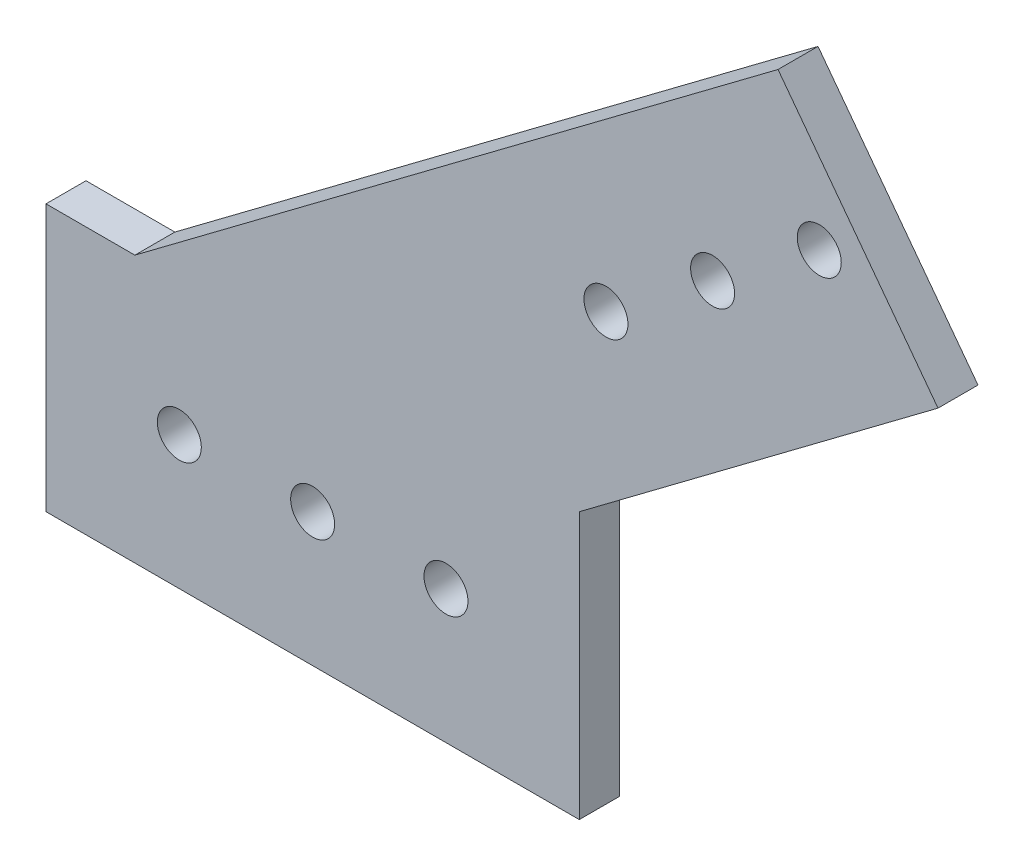
from build123d import *

# Parameters (mm, degrees)
SKETCH_1_R      = 1.65
EXTRUDE_1_DEPTH = 3


with BuildPart() as part:
    # 草图1 → 凸台-拉伸1 (new body)
    with BuildSketch(Plane.XY):
        Polygon((-18.830697363, -8.06225338), (-25.497363461, -8.06225338), (-25.497363461, -28.06225338), (14.502631424, -28.06225338), (14.502631424, -8.06225338), (41.408851068, 12.117415653), (29.408849432, 28.117414426), align=None)
        with Locations((-5.497363461, -18.06225338)):
            Circle(SKETCH_1_R, mode=Mode.SUBTRACT)
        with Locations((4.502636539, -18.06225338)):
            Circle(SKETCH_1_R, mode=Mode.SUBTRACT)
        with Locations((-15.497363461, -18.06225338)):
            Circle(SKETCH_1_R, mode=Mode.SUBTRACT)
        with Locations((16.502629992, 5.937746824)):
            Circle(SKETCH_1_R, mode=Mode.SUBTRACT)
        with Locations((24.502629378, 11.937747642)):
            Circle(SKETCH_1_R, mode=Mode.SUBTRACT)
        with Locations((32.502628764, 17.937748461)):
            Circle(SKETCH_1_R, mode=Mode.SUBTRACT)
    extrude(amount=EXTRUDE_1_DEPTH)


solid = part.part
